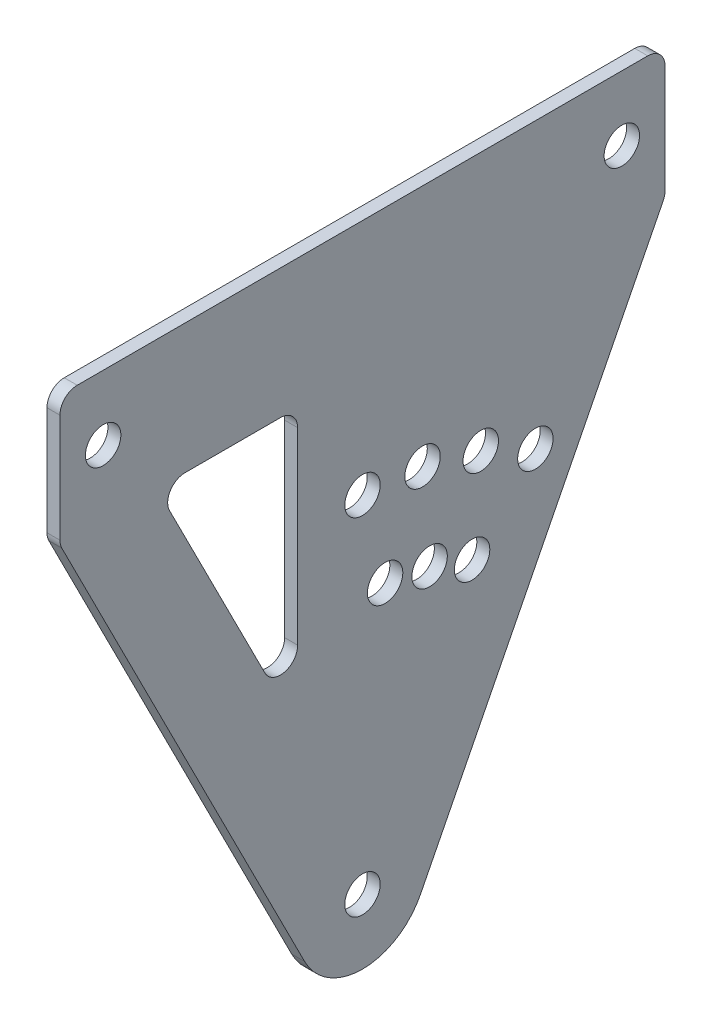
from build123d import *

# Parameters (mm, degrees)
SKETCH_1_R      = 2.05
EXTRUDE_1_DEPTH = 1.5
FILLET_2_R      = 2


with BuildPart() as part:
    # ｽｹｯﾁ1 → ﾎﾞｽ - 押し出し1 (new body)
    with BuildSketch(Plane(origin=(0, 0, 0), x_dir=(0, 0, -1), z_dir=(1, 0, 0))):
        with BuildLine():
            Line((35, 67.5), (-35, 67.5))
            Line((-35, 67.5), (-35, 52.5))
            Line((-35, 52.5), (-6.690641581, -3.388999149))
            ThreePointArc((-6.690641581, -3.388999149), (0, -7.5), (6.690641581, -3.388999149))
            Line((6.690641581, -3.388999149), (35, 52.5))
            Line((35, 52.5), (35, 67.5))
        make_face()
        Circle(SKETCH_1_R, mode=Mode.SUBTRACT)
        with Locations((2.614672282, 29.885840943)):
            Circle(SKETCH_1_R, mode=Mode.SUBTRACT)
        with Locations((7.764571353, 28.977774789)):
            Circle(SKETCH_1_R, mode=Mode.SUBTRACT)
        with Locations((12.678547852, 27.189233611)):
            Circle(SKETCH_1_R, mode=Mode.SUBTRACT)
        Polygon((-7.5, 20.339282727), (-23.790312694, 52.5), (-7.5, 52.5), align=None, mode=Mode.SUBTRACT)
        with Locations((-30, 60)):
            Circle(SKETCH_1_R, mode=Mode.SUBTRACT)
        with Locations((13.680805733, 37.587704831)):
            Circle(SKETCH_1_R, mode=Mode.SUBTRACT)
        with Locations((0, 40)):
            Circle(SKETCH_1_R, mode=Mode.SUBTRACT)
        with Locations((6.945927107, 39.39231012)):
            Circle(SKETCH_1_R, mode=Mode.SUBTRACT)
        with Locations((20, 34.641016151)):
            Circle(SKETCH_1_R, mode=Mode.SUBTRACT)
        with Locations((30, 60)):
            Circle(SKETCH_1_R, mode=Mode.SUBTRACT)
    extrude(amount=EXTRUDE_1_DEPTH)

    # ﾌｨﾚｯﾄ2
    fillet_2_edges = [part.edges().sort_by_distance(p)[0] for p in [
        (0.75, 52.5, 35),
        (0.75, 67.5, 35),
        (0.75, 67.5, -35),
        (0.75, 52.5, -35),
        (0.75, 52.5, 23.790312694),
        (0.75, 20.339282727, 7.5),
        (0.75, 52.5, 7.5),
    ]]
    fillet(fillet_2_edges, radius=FILLET_2_R)


solid = part.part
